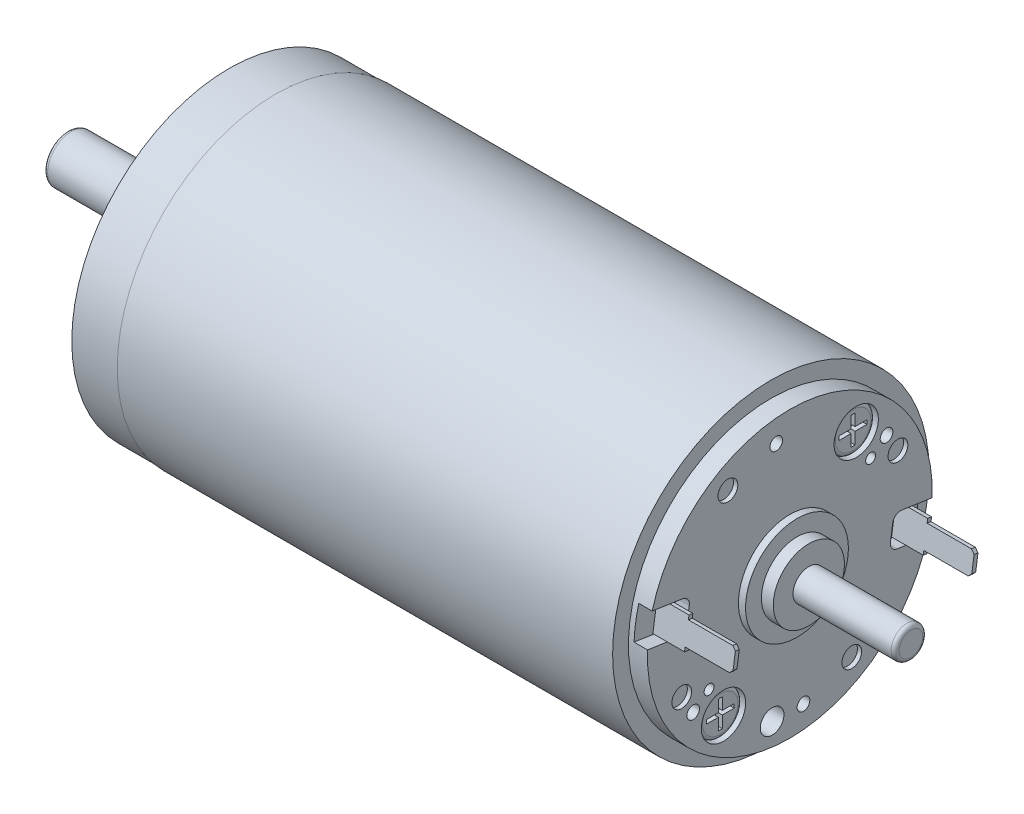
from build123d import *

# Parameters (mm, degrees)
SKETCH1_W                        = 62.6
SKETCH1_H                        = 20
SKETCH2_R                        = 18
BOSS_EXTRUDE1_DEPTH              = 2.4
CUT_EXTRUDE1_START               = -1.7
CUT_EXTRUDE1_DEPTH               = 1.7
BOSS_EXTRUDE2_DEPTH              = 10
SKETCH5_W                        = 6
SKETCH5_H                        = 0.5
CUT_EXTRUDE2_DEPTH               = 90.418036015
SKETCH6_W                        = 6
SKETCH6_H                        = 0.5
CUT_EXTRUDE3_DEPTH               = 90.418036015
CUT_EXTRUDE4_START               = -1.7
CUT_EXTRUDE4_DEPTH               = 1.7
BOSS_EXTRUDE3_DEPTH              = 10
SKETCH9_W                        = 6
SKETCH9_H                        = 0.5
CUT_EXTRUDE5_DEPTH               = 90.418036015
SKETCH10_W                       = 6
SKETCH10_H                       = 0.5
CUT_EXTRUDE6_DEPTH               = 90.418036015
SKETCH11_R                       = 19.9
BOSS_EXTRUDE4_DEPTH              = 5.85
SKETCH12_R                       = 18.5
BOSS_EXTRUDE5_DEPTH              = 0.15
SKETCH13_R                       = 8
BOSS_EXTRUDE6_DEPTH              = 1.4
SKETCH14_R                       = 4.5
BOSS_EXTRUDE7_DEPTH              = 2.15
SKETCH15_R                       = 3
BOSS_EXTRUDE8_DEPTH              = 16.75
SKETCH16_R                       = 6.5
BOSS_EXTRUDE9_DEPTH              = 0.9
BOSS_EXTRUDE10_START             = 1.5
SKETCH17_R                       = 4.5
BOSS_EXTRUDE10_DEPTH             = 1.5
SKETCH18_R                       = 2
BOSS_EXTRUDE11_DEPTH             = 12.9
F_5_6_5_6_DIAMETER_HOLE1_D       = 5.6
F_5_6_5_6_DIAMETER_HOLE1_DEPTH   = 2.4
SKETCH21_R                       = 2.75
BOSS_EXTRUDE12_DEPTH             = 2
CUT_EXTRUDE7_DEPTH               = 0.86
F_5_6_5_6_DIAMETER_HOLE2_D       = 5.6
F_5_6_5_6_DIAMETER_HOLE2_DEPTH   = 2.4
SKETCH25_R                       = 2.75
BOSS_EXTRUDE13_DEPTH             = 2
CUT_EXTRUDE8_DEPTH               = 0.86
F_3_0_3_DIAMETER_HOLE1_D         = 3
F_3_0_3_DIAMETER_HOLE1_DEPTH     = 3.4
F_2_5_2_5_DIAMETER_HOLE1_D       = 2.5
F_2_5_2_5_DIAMETER_HOLE1_DEPTH   = 0.54
F_1_25_1_25_DIAMETER_HOLE1_D     = 1.25
F_1_25_1_25_DIAMETER_HOLE1_DEPTH = 3.75
F_1_25_1_25_DIAMETER_HOLE1_TIP   = 0.360843918
F_1_6_1_6_DIAMETER_HOLE1_D       = 1.6
F_1_6_1_6_DIAMETER_HOLE1_DEPTH   = 4.8
F_1_6_1_6_DIAMETER_HOLE1_TIP     = 0.461880215
F_2_5_2_5_DIAMETER_HOLE2_D       = 2.5
F_2_5_2_5_DIAMETER_HOLE2_DEPTH   = 7.5
F_2_5_2_5_DIAMETER_HOLE2_TIP     = 0.721687836
F_2_8_2_8_DIAMETER_HOLE1_D       = 2.8
F_2_8_2_8_DIAMETER_HOLE1_DEPTH   = 1.2
F_2_8_2_8_DIAMETER_HOLE1_TIP     = 0.808290377
CHAMFER1_SIZE                    = 0.4
FILLET1_R                        = 0.5
FILLET2_R                        = 1


with BuildPart() as part:
    # Sketch1 → Revolve1 (revolve)
    with BuildSketch(Plane.XY, mode=Mode.PRIVATE) as revolve1_sk:
        with Locations((37.3, 10)):
            Rectangle(SKETCH1_W, SKETCH1_H)
    revolve(revolve1_sk.sketch.rotate(Axis((6, 0, 0), (1, 0, 0)), 270), axis=Axis((6, 0, 0), (1, 0, 0)))

    # Sketch2 → Boss-Extrude1 (add)
    with BuildSketch(Plane(origin=(68.6, 0, 0), x_dir=(0, 0, -1), z_dir=(1, 0, 0))):
        Circle(SKETCH2_R)
    extrude(amount=BOSS_EXTRUDE1_DEPTH)

    # Sketch3 → Cut-Extrude1 (cut)
    with BuildSketch(Plane(origin=(71, 0, 0), x_dir=(0, 0, -1), z_dir=(1, 0, 0)).offset(CUT_EXTRUDE1_START)):
        with BuildLine():
            Line((17.987672433, -0.666063401), (13.152825046, 0.056509382))
            Line((13.152825046, 0.056509382), (12.561587401, -3.899554071))
            Line((12.561587401, -3.899554071), (17.396434788, -4.622126855))
            ThreePointArc((17.396434788, -4.622126855), (17.802285541, -2.6605694), (17.987672433, -0.666063401))
        make_face()
    extrude(amount=CUT_EXTRUDE1_DEPTH, mode=Mode.SUBTRACT)

    # Sketch4 → Boss-Extrude2 (add)
    with BuildSketch(Plane(origin=(69.3, 0, 0), x_dir=(0, 0, -1), z_dir=(1, 0, 0))):
        Polygon((15.048908001, -4.170176013), (14.554400069, -4.096271307), (15.116075832, -0.338011027), (15.610583763, -0.411915732), align=None)
    extrude(amount=BOSS_EXTRUDE2_DEPTH)

    # Sketch5 → Cut-Extrude2 (cut, through all)
    with BuildSketch(Plane(origin=(0, -2.217141167, -14.83523795), x_dir=(1, 0, 0), z_dir=(0, 0.14780941113152232, 0.9890158633616313))):
        with Locations((76.3, 1.65)):
            Rectangle(SKETCH5_W, SKETCH5_H)
    extrude(amount=-CUT_EXTRUDE2_DEPTH, mode=Mode.SUBTRACT)

    # Sketch6 → Cut-Extrude3 (cut, through all)
    with BuildSketch(Plane(origin=(0, -2.217141167, -14.83523795), x_dir=(1, 0, 0), z_dir=(0, 0.14780941113152232, 0.9890158633616313))):
        with Locations((76.3, -1.65)):
            Rectangle(SKETCH6_W, SKETCH6_H)
    extrude(amount=-CUT_EXTRUDE3_DEPTH, mode=Mode.SUBTRACT)

    # Sketch7 → Cut-Extrude4 (cut)
    with BuildSketch(Plane(origin=(71, 0, 0), x_dir=(0, 0, -1), z_dir=(1, 0, 0)).offset(CUT_EXTRUDE4_START)):
        with BuildLine():
            Line((-17.987672433, 0.666063401), (-13.152825046, -0.056509382))
            Line((-13.152825046, -0.056509382), (-12.561587401, 3.899554071))
            Line((-12.561587401, 3.899554071), (-17.396434788, 4.622126855))
            ThreePointArc((-17.396434788, 4.622126855), (-17.802285541, 2.6605694), (-17.987672433, 0.666063401))
        make_face()
    extrude(amount=CUT_EXTRUDE4_DEPTH, mode=Mode.SUBTRACT)

    # Sketch8 → Boss-Extrude3 (add)
    with BuildSketch(Plane(origin=(69.3, 0, 0), x_dir=(0, 0, -1), z_dir=(1, 0, 0))):
        Polygon((-15.048908001, 4.170176013), (-14.554400069, 4.096271307), (-15.116075832, 0.338011027), (-15.610583763, 0.411915732), align=None)
    extrude(amount=BOSS_EXTRUDE3_DEPTH)

    # Sketch9 → Cut-Extrude5 (cut, through all)
    with BuildSketch(Plane(origin=(0, 2.217141167, 14.83523795), x_dir=(-1, 0, 0), z_dir=(0, -0.14780941113151586, -0.9890158633616322))):
        with Locations((-76.3, -1.65)):
            Rectangle(SKETCH9_W, SKETCH9_H)
    extrude(amount=-CUT_EXTRUDE5_DEPTH, mode=Mode.SUBTRACT)

    # Sketch10 → Cut-Extrude6 (cut, through all)
    with BuildSketch(Plane(origin=(0, 2.217141167, 14.83523795), x_dir=(-1, 0, 0), z_dir=(0, -0.14780941113151586, -0.9890158633616322))):
        with Locations((-76.3, 1.65)):
            Rectangle(SKETCH10_W, SKETCH10_H)
    extrude(amount=-CUT_EXTRUDE6_DEPTH, mode=Mode.SUBTRACT)

    # Sketch11 → Boss-Extrude4 (add)
    with BuildSketch(Plane.ZY.offset(-6)):
        Circle(SKETCH11_R)
    extrude(amount=BOSS_EXTRUDE4_DEPTH)

    # Sketch12 → Boss-Extrude5 (add)
    with BuildSketch(Plane.ZY.offset(-0.15)):
        Circle(SKETCH12_R)
    extrude(amount=BOSS_EXTRUDE5_DEPTH)

    # Sketch13 → Boss-Extrude6 (add)
    with BuildSketch(Plane.ZY):
        Circle(SKETCH13_R)
    extrude(amount=BOSS_EXTRUDE6_DEPTH)

    # Sketch14 → Boss-Extrude7 (add)
    with BuildSketch(Plane.ZY.offset(1.4)):
        with Locations(Location((0, 0, 0), (0, 0, 180))):
            Circle(SKETCH14_R)
    extrude(amount=BOSS_EXTRUDE7_DEPTH)

    # Sketch15 → Boss-Extrude8 (add)
    with BuildSketch(Plane.ZY.offset(3.55)):
        Circle(SKETCH15_R)
    extrude(amount=BOSS_EXTRUDE8_DEPTH)

    # Sketch16 → Boss-Extrude9 (add)
    with BuildSketch(Plane(origin=(71, 0, 0), x_dir=(0, 0, -1), z_dir=(1, 0, 0))):
        Circle(SKETCH16_R)
    extrude(amount=BOSS_EXTRUDE9_DEPTH)

    # Sketch17 → Boss-Extrude10 (add)
    with BuildSketch(Plane(origin=(71.9, 0, 0), x_dir=(0, 0, -1), z_dir=(1, 0, 0)).offset(BOSS_EXTRUDE10_START)):
        Circle(SKETCH17_R)
    extrude(amount=-BOSS_EXTRUDE10_DEPTH)

    # Sketch18 → Boss-Extrude11 (add)
    with BuildSketch(Plane(origin=(73.4, 0, 0), x_dir=(0, 0, -1), z_dir=(1, 0, 0))):
        Circle(SKETCH18_R)
    extrude(amount=BOSS_EXTRUDE11_DEPTH)

    # Ø5.6 (5.6) Diameter Hole1
    with Locations(Plane(origin=(71, 0, 0), x_dir=(0, 0, -1), z_dir=(1, 0, 0))):
        with Locations((8.387001293, 11.334381735)):
            Hole(F_5_6_5_6_DIAMETER_HOLE1_D / 2, depth=F_5_6_5_6_DIAMETER_HOLE1_DEPTH)

    # Sketch21 → Boss-Extrude12 (add)
    with BuildSketch(Plane(origin=(68.6, 0, 0), x_dir=(0, 0, -1), z_dir=(1, 0, 0))):
        with Locations(Location((8.387001293, 11.334381735, 0), (0, 0, 180))):
            Circle(SKETCH21_R)
    extrude(amount=BOSS_EXTRUDE12_DEPTH)

    # Sketch22 → Cut-Extrude7 (cut)
    with BuildSketch(Plane(origin=(70.6, 0, 0), x_dir=(0, 0, -1), z_dir=(1, 0, 0))):
        Polygon((8.137001293, 13.084381735), (8.137001293, 11.584381735), (6.637001293, 11.584381735), (6.637001293, 11.084381735), (8.137001293, 11.084381735), (8.137001293, 9.584381735), (8.637001293, 9.584381735), (8.637001293, 11.084381735), (10.137001293, 11.084381735), (10.137001293, 11.584381735), (8.637001293, 11.584381735), (8.637001293, 13.084381735), align=None)
    extrude(amount=-CUT_EXTRUDE7_DEPTH, mode=Mode.SUBTRACT)

    # Ø5.6 (5.6) Diameter Hole2
    with Locations(Plane(origin=(71, 0, 0), x_dir=(0, 0, -1), z_dir=(1, 0, 0))):
        with Locations((-8.387001293, -11.334381735)):
            Hole(F_5_6_5_6_DIAMETER_HOLE2_D / 2, depth=F_5_6_5_6_DIAMETER_HOLE2_DEPTH)

    # Sketch25 → Boss-Extrude13 (add)
    with BuildSketch(Plane(origin=(68.6, 0, 0), x_dir=(0, 0, -1), z_dir=(1, 0, 0))):
        with Locations(Location((-8.387001293, -11.334381735, 0), (0, 0, 180))):
            Circle(SKETCH25_R)
    extrude(amount=BOSS_EXTRUDE13_DEPTH)

    # Sketch26 → Cut-Extrude8 (cut)
    with BuildSketch(Plane(origin=(70.6, 0, 0), x_dir=(0, 0, -1), z_dir=(1, 0, 0))):
        Polygon((-8.637001293, -9.584381735), (-8.637001293, -11.084381735), (-10.137001293, -11.084381735), (-10.137001293, -11.584381735), (-8.637001293, -11.584381735), (-8.637001293, -13.084381735), (-8.137001293, -13.084381735), (-8.137001293, -11.584381735), (-6.637001293, -11.584381735), (-6.637001293, -11.084381735), (-8.137001293, -11.084381735), (-8.137001293, -9.584381735), align=None)
    extrude(amount=-CUT_EXTRUDE8_DEPTH, mode=Mode.SUBTRACT)

    # Ø3.0 (3) Diameter Hole1
    with Locations(Plane(origin=(71, 0, 0), x_dir=(0, 0, -1), z_dir=(1, 0, 0))):
        with Locations((-2.242983813, -15.034793767)):
            Hole(F_3_0_3_DIAMETER_HOLE1_D / 2, depth=F_3_0_3_DIAMETER_HOLE1_DEPTH)

    # Ø2.5 (2.5) Diameter Hole1
    with Locations(Plane(origin=(71, 0, 0), x_dir=(0, 0, -1), z_dir=(1, 0, 0))):
        with Locations((7.828578739, -13.028942971), (-7.828578739, 13.028942971), (13.661669504, 6.663241431), (-13.661669504, -6.663241431)):
            Hole(F_2_5_2_5_DIAMETER_HOLE1_D / 2, depth=F_2_5_2_5_DIAMETER_HOLE1_DEPTH)

    # Ø1.25 (1.25) Diameter Hole1
    with Locations(Plane(origin=(71, 0, 0), x_dir=(0, 0, -1), z_dir=(1, 0, 0))):
        with Locations((10.20898213, 7.554249392), (-10.20898213, -7.554249392)):
            Hole(F_1_25_1_25_DIAMETER_HOLE1_D / 2, depth=F_1_25_1_25_DIAMETER_HOLE1_DEPTH)
            with Locations((0, 0, -(F_1_25_1_25_DIAMETER_HOLE1_DEPTH + F_1_25_1_25_DIAMETER_HOLE1_TIP / 2))):  # 120° drill point
                Cone(0, F_1_25_1_25_DIAMETER_HOLE1_D / 2, F_1_25_1_25_DIAMETER_HOLE1_TIP, mode=Mode.SUBTRACT)

    # Ø1.6 (1.6) Diameter Hole1
    with Locations(Plane(origin=(71, 0, 0), x_dir=(0, 0, -1), z_dir=(1, 0, 0))):
        with Locations((-1.720688849, 15.102292206), (1.720688849, -15.102292206), (12.218624281, 9.041306359), (-12.218624281, -9.041306359)):
            Hole(F_1_6_1_6_DIAMETER_HOLE1_D / 2, depth=F_1_6_1_6_DIAMETER_HOLE1_DEPTH)
            with Locations((0, 0, -(F_1_6_1_6_DIAMETER_HOLE1_DEPTH + F_1_6_1_6_DIAMETER_HOLE1_TIP / 2))):  # 120° drill point
                Cone(0, F_1_6_1_6_DIAMETER_HOLE1_D / 2, F_1_6_1_6_DIAMETER_HOLE1_TIP, mode=Mode.SUBTRACT)

    # Ø2.5 (2.5) Diameter Hole2
    with Locations(Plane.ZY):
        with Locations((0, 11), (9.526279442, 5.5), (9.526279442, -5.5), (0, -11), (-9.526279442, -5.5), (-9.526279442, 5.5)):
            Hole(F_2_5_2_5_DIAMETER_HOLE2_D / 2, depth=F_2_5_2_5_DIAMETER_HOLE2_DEPTH)
            with Locations((0, 0, -(F_2_5_2_5_DIAMETER_HOLE2_DEPTH + F_2_5_2_5_DIAMETER_HOLE2_TIP / 2))):  # 120° drill point
                Cone(0, F_2_5_2_5_DIAMETER_HOLE2_D / 2, F_2_5_2_5_DIAMETER_HOLE2_TIP, mode=Mode.SUBTRACT)

    # Ø2.8 (2.8) Diameter Hole1
    with Locations(Plane.ZY):
        with Locations((0, 15)):
            Hole(F_2_8_2_8_DIAMETER_HOLE1_D / 2, depth=F_2_8_2_8_DIAMETER_HOLE1_DEPTH)
            with Locations((0, 0, -(F_2_8_2_8_DIAMETER_HOLE1_DEPTH + F_2_8_2_8_DIAMETER_HOLE1_TIP / 2))):  # 120° drill point
                Cone(0, F_2_8_2_8_DIAMETER_HOLE1_D / 2, F_2_8_2_8_DIAMETER_HOLE1_TIP, mode=Mode.SUBTRACT)

    # Chamfer1
    chamfer1_edges = [part.edges().sort_by_distance(p)[0] for p in [
        (79.3, 0.869471311, 15.289425092),
        (79.3, 3.638715728, 14.875558741),
        (79.3, -0.869471311, -15.289425092),
        (79.3, -3.638715728, -14.875558741),
    ]]
    chamfer(chamfer1_edges, length=CHAMFER1_SIZE)

    # Fillet1
    fillet1_edges = [part.edges().sort_by_distance(p)[0] for p in [
        (-20.3, 0, -3),
        (86.3, 0, 2),
        (70.6, 11.334381735, -11.137001293),
        (70.6, -11.334381735, 5.637001293),
    ]]
    fillet(fillet1_edges, radius=FILLET1_R)

    # Fillet2
    fillet2_edges = [part.edges().sort_by_distance(p)[0] for p in [
        (70.15, -3.899554071, -12.561587401),
        (70.15, 0.056509382, -13.152825046),
        (70.15, 3.899554071, 12.561587401),
        (70.15, -0.056509382, 13.152825046),
    ]]
    fillet(fillet2_edges, radius=FILLET2_R)


solid = part.part
